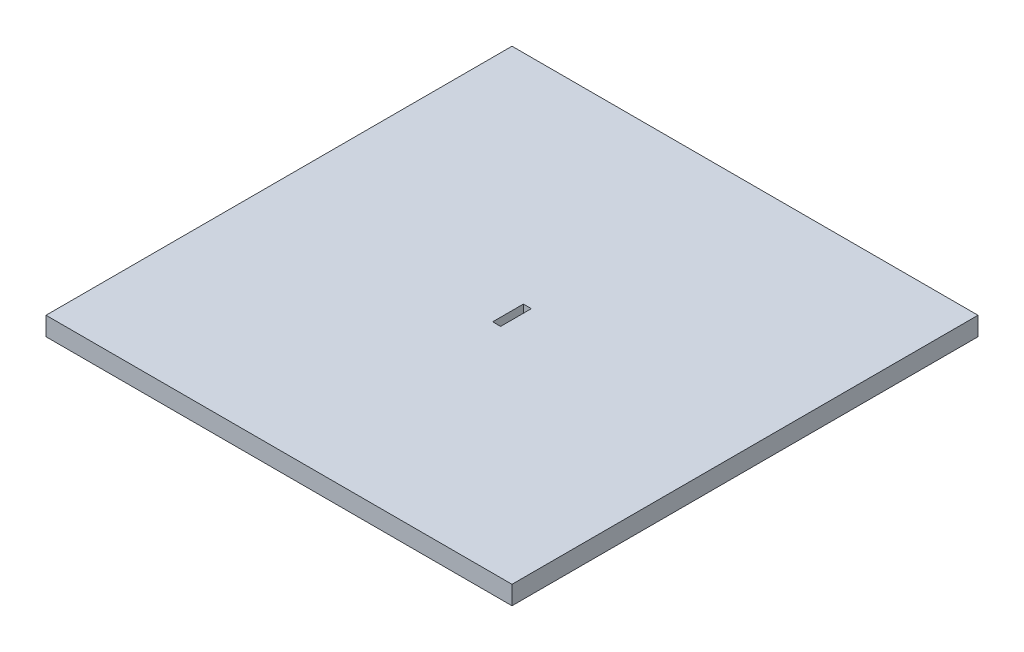
from build123d import *

# Parameters (mm, degrees)
SKETCH2_W           = 100
SKETCH2_H           = 100
BOSS_EXTRUDE1_DEPTH = 4
SKETCH3_W           = 1.71
SKETCH3_H           = 6.6
CUT_EXTRUDE1_DEPTH  = 4


with BuildPart() as part:
    # Sketch2 → Boss-Extrude1 (new body)
    with BuildSketch(Plane(origin=(0, 0, 0), x_dir=(1, 0, 0), z_dir=(0, 1, 0))):
        Rectangle(SKETCH2_W, SKETCH2_H)
    extrude(amount=BOSS_EXTRUDE1_DEPTH)

    # Sketch3 → Cut-Extrude1 (cut)
    with BuildSketch(Plane(origin=(0, 4, 0), x_dir=(1, 0, 0), z_dir=(0, 1, 0))):
        Rectangle(SKETCH3_W, SKETCH3_H)
    extrude(amount=-CUT_EXTRUDE1_DEPTH, mode=Mode.SUBTRACT)


solid = part.part
